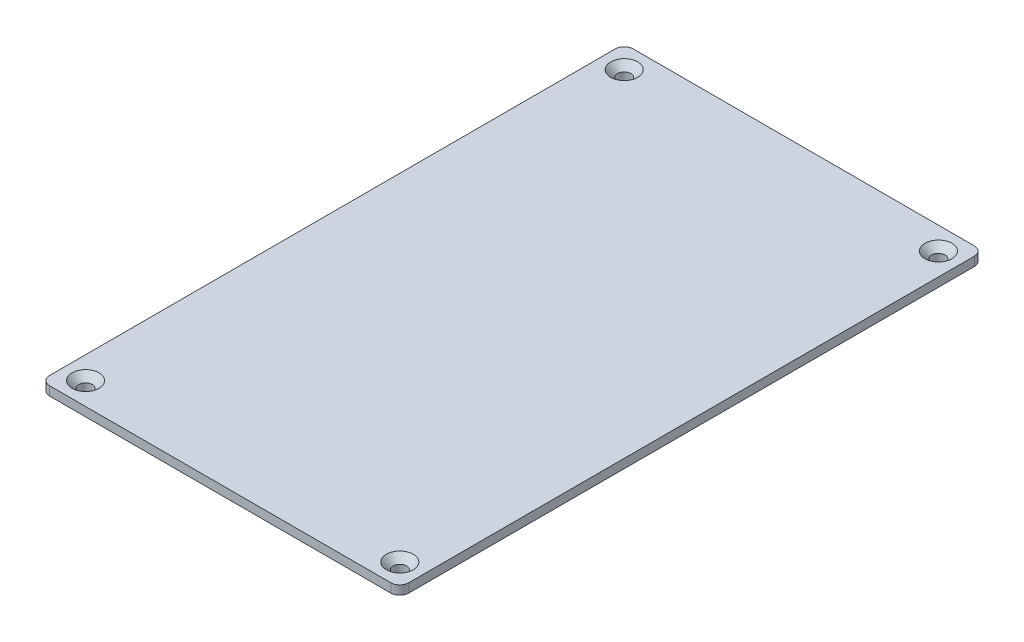
from build123d import *

# Parameters (mm, degrees)
SKETCH1_W           = 75.6
SKETCH1_H           = 125.6
BOSS_EXTRUDE1_DEPTH = 1.8
SKETCH2_W           = 80
SKETCH2_H           = 130
BOSS_EXTRUDE2_DEPTH = 2
SKETCH3_R           = 1.5
CUT_EXTRUDE1_DEPTH  = 77.416228643
CHAMFER1_SIZE       = 1.5
FILLET1_R           = 2


with BuildPart() as part:
    # Sketch1 → Boss-Extrude1 (new body)
    with BuildSketch(Plane(origin=(0, 0, 0), x_dir=(1, 0, 0), z_dir=(0, 1, 0))):
        Rectangle(SKETCH1_W, SKETCH1_H)
    extrude(amount=BOSS_EXTRUDE1_DEPTH)

    # Sketch2 → Boss-Extrude2 (add)
    with BuildSketch(Plane(origin=(0, 1.8, 0), x_dir=(1, 0, 0), z_dir=(0, 1, 0))):
        Rectangle(SKETCH2_W, SKETCH2_H)
    extrude(amount=BOSS_EXTRUDE2_DEPTH)

    # Sketch3 → Cut-Extrude1 (cut, through all)
    with BuildSketch(Plane(origin=(0, 3.8, 0), x_dir=(1, 0, 0), z_dir=(0, 1, 0))):
        with Locations(Location((-35, 60, 0), (0, 0, 270))):
            Circle(SKETCH3_R)
        with Locations(Location((35, 60, 0), (0, 0, 270))):
            Circle(SKETCH3_R)
        with Locations(Location((35, -60, 0), (0, 0, 270))):
            Circle(SKETCH3_R)
        with Locations(Location((-35, -60, 0), (0, 0, 270))):
            Circle(SKETCH3_R)
    extrude(amount=-CUT_EXTRUDE1_DEPTH, mode=Mode.SUBTRACT)

    # Chamfer1
    chamfer1_edges = [part.edges().sort_by_distance(p)[0] for p in [
        (-35, 3.8, 58.5),
        (35, 3.8, 58.5),
        (35, 3.8, -61.5),
        (-35, 3.8, -61.5),
    ]]
    chamfer(chamfer1_edges, length=CHAMFER1_SIZE)

    # Fillet1
    fillet1_edges = [part.edges().sort_by_distance(p)[0] for p in [
        (40, 2.8, 65),
        (40, 2.8, -65),
        (-40, 2.8, -65),
        (-40, 2.8, 65),
        (37.8, 0.9, 62.8),
        (-37.8, 0.9, 62.8),
        (-37.8, 0.9, -62.8),
        (37.8, 0.9, -62.8),
    ]]
    fillet(fillet1_edges, radius=FILLET1_R)


solid = part.part
